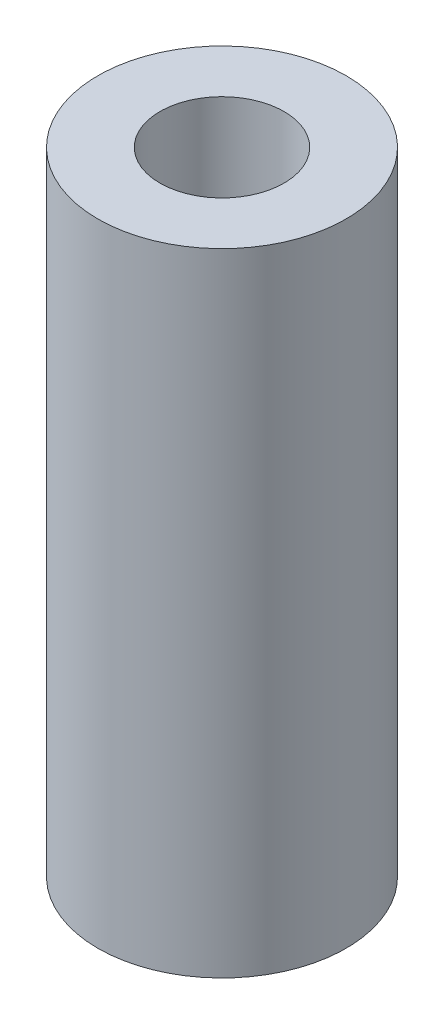
from build123d import *

# Parameters (mm, degrees)
SKETCH_1_R      = 4.5
SKETCH_1_R_2    = 2.25
EXTRUDE_1_DEPTH = 22.9


with BuildPart() as part:
    # 草图1 → 凸台-拉伸1 (new body)
    with BuildSketch(Plane(origin=(0, 0, 0), x_dir=(1, 0, 0), z_dir=(0, 1, 0))):
        with Locations(Location((0, 0, 0), (0, 0, 270))):
            Circle(SKETCH_1_R)
        with Locations(Location((0, 0, 0), (0, 0, 270))):
            Circle(SKETCH_1_R_2, mode=Mode.SUBTRACT)
    extrude(amount=EXTRUDE_1_DEPTH)


solid = part.part
